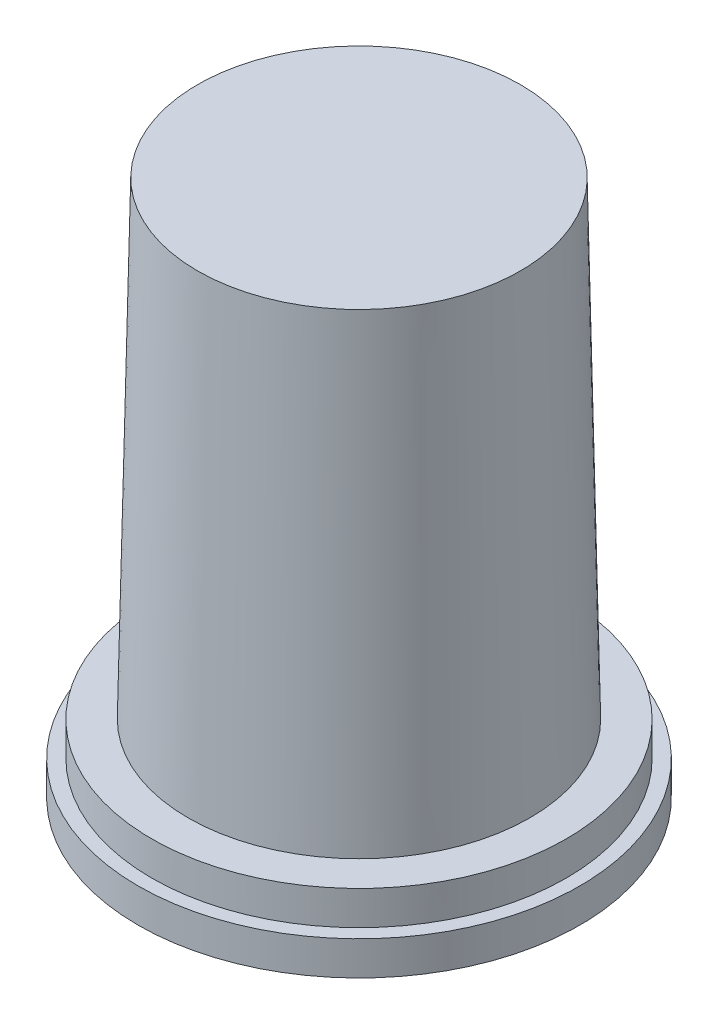
from build123d import *

# Parameters (mm, degrees)
INSIDEBOREF_R = 0.5


with BuildPart() as part:
    # MainBodyS → MainBody (revolve)
    with BuildSketch(Plane.XY, mode=Mode.PRIVATE) as mainbody_sk:
        Polygon((0, 15.8), (4.75, 15.8), (5.05, 1), (6.5, 1), (6.5, 0), (4.070064849, 0), (3.784254039, 14.1), (0, 14.1), align=None)
    revolve(mainbody_sk.sketch.rotate(Axis((0, 0, 0), (0, 1, 0)), 90), axis=Axis((0, 0, 0), (0, 1, 0)))

    # InsertBodyS → InsertBody (revolve)
    with BuildSketch(Plane.XY, mode=Mode.PRIVATE) as insertbody_sk:
        Polygon((5.02972973, 2), (6.1, 2), (6.1, 1), (5.05, 1), align=None)
    revolve(insertbody_sk.sketch.rotate(Axis((0, 1, 0), (0, -1, 0)), 270), axis=Axis((0, 1, 0), (0, -1, 0)))

    # InsideBoreF
    insideboref_edges = [part.edges().sort_by_distance(p)[0] for p in [
        (0, 0, 4.070064849),
    ]]
    fillet(insideboref_edges, radius=INSIDEBOREF_R)


solid = part.part
